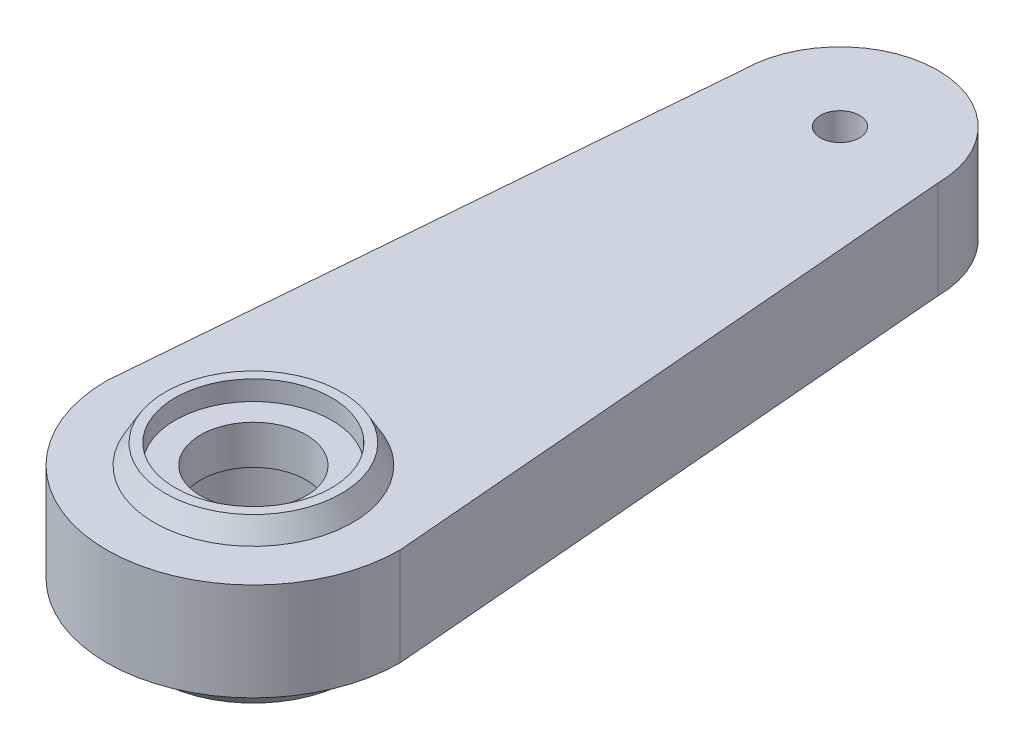
from build123d import *

# Parameters (mm, degrees)
BOSS_EXTRUDE1_DEPTH = 5
SKETCH2_R           = 4
SKETCH2_R_2         = 1
CUT_EXTRUDE1_DEPTH  = 5
SKETCH3_R           = 5
BOSS_EXTRUDE3_DEPTH = 2
DRAFT3_ANGLE        = 30
SKETCH4_R           = 4
CUT_EXTRUDE2_DEPTH  = 2
SKETCH5_R           = 4
SKETCH5_R_2         = 2.700917016
BOSS_EXTRUDE4_DEPTH = 2
BOSS_EXTRUDE5_START = 1
SKETCH6_R           = 4.5
SKETCH6_R_2         = 4
BOSS_EXTRUDE5_DEPTH = 1
DRAFT4_ANGLE        = 30


with BuildPart() as part:
    # Sketch1 → Boss-Extrude1 (new body)
    with BuildSketch(Plane(origin=(0, 0, 0), x_dir=(1, 0, 0), z_dir=(0, 1, 0))):
        with BuildLine():
            Line((-7.5, 0), (-5, 30))
            ThreePointArc((-5, 30), (0, 35), (5, 30))
            Line((5, 30), (7.5, 0))
            ThreePointArc((7.5, 0), (0, -7.5), (-7.5, 0))
        make_face()
    extrude(amount=BOSS_EXTRUDE1_DEPTH)

    # Sketch2 → Cut-Extrude1 (cut)
    with BuildSketch(Plane(origin=(0, 5, 0), x_dir=(1, 0, 0), z_dir=(0, 1, 0))):
        with Locations(Location((0, 0, 0), (0, 0, 270))):
            Circle(SKETCH2_R)
        with Locations(Location((0, 30, 0), (0, 0, 270))):
            Circle(SKETCH2_R_2)
    extrude(amount=-CUT_EXTRUDE1_DEPTH, mode=Mode.SUBTRACT)

    # Sketch3 → Boss-Extrude3 (add)
    with BuildSketch(Plane.XZ):
        with Locations(Location((0, 0, 0), (0, 0, 90))):
            Circle(SKETCH3_R)
    extrude(amount=BOSS_EXTRUDE3_DEPTH)

    # Draft3
    draft3_faces = [part.faces().sort_by_distance(p)[0] for p in [
        (0, -1, -5),
    ]]
    draft(draft3_faces, Plane(origin=(0, -2, 0), x_dir=(0, 0, -1), z_dir=(0, -1, 0)), DRAFT3_ANGLE)

    # Sketch4 → Cut-Extrude2 (cut)
    with BuildSketch(Plane(origin=(0, 0, 0), x_dir=(1, 0, 0), z_dir=(0, 1, 0))):
        with Locations(Location((0, 0, 0), (0, 0, 270))):
            Circle(SKETCH4_R)
    extrude(amount=-CUT_EXTRUDE2_DEPTH, mode=Mode.SUBTRACT)

    # Sketch5 → Boss-Extrude4 (add)
    with BuildSketch(Plane(origin=(0, 5, 0), x_dir=(1, 0, 0), z_dir=(0, 1, 0))):
        with Locations(Location((0, 0, 0), (0, 0, 270))):
            Circle(SKETCH5_R)
        with Locations(Location((0, 0, 0), (0, 0, 270))):
            Circle(SKETCH5_R_2, mode=Mode.SUBTRACT)
    extrude(amount=-BOSS_EXTRUDE4_DEPTH)

    # Sketch6 → Boss-Extrude5 (add)
    with BuildSketch(Plane(origin=(0, 5, 0), x_dir=(1, 0, 0), z_dir=(0, 1, 0)).offset(BOSS_EXTRUDE5_START)):
        with Locations(Location((0, 0, 0), (0, 0, 270))):
            Circle(SKETCH6_R)
        with Locations(Location((0, 0, 0), (0, 0, 270))):
            Circle(SKETCH6_R_2, mode=Mode.SUBTRACT)
    extrude(amount=-BOSS_EXTRUDE5_DEPTH)

    # Draft4
    draft4_faces = [part.faces().sort_by_distance(p)[0] for p in [
        (0, 5.5, -4.5),
    ]]
    draft(draft4_faces, Plane.ZX.offset(6), DRAFT4_ANGLE)


solid = part.part
